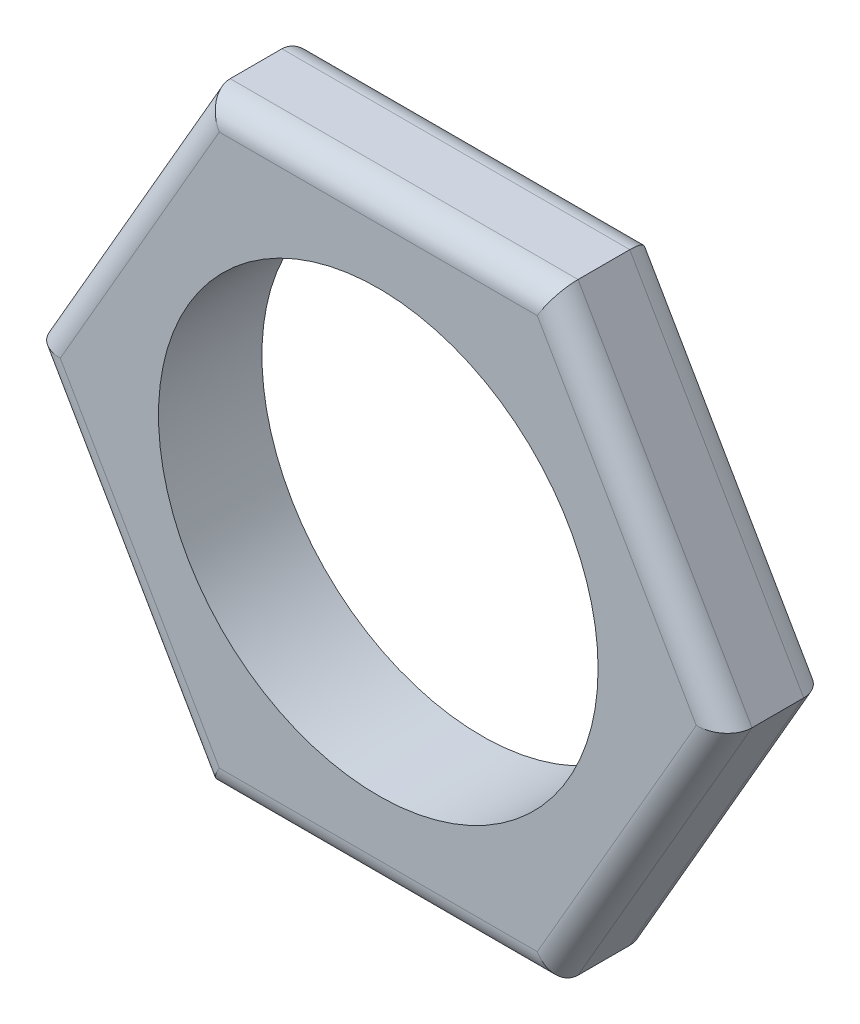
from build123d import *

# Parameters (mm, degrees)
SKETCH1_R      = 4.317999999999999
EXTRUDE1_DEPTH = 2.032
FILLET1_R      = 0.508


with BuildPart() as part:
    # Sketch1 → Extrude1 (new body)
    with BuildSketch(Plane.XY):
        Polygon((-5.125311544677072, 2.9590999999999883), (-6.833748726236091, -2.364e-14), (-5.125311544677051, -2.959100000000024), (-3.4168743631180254, -5.918200000000001), (0, -5.918200000000001), (3.4168743631180534, -5.918200000000001), (5.125311544677072, -2.9590999999999883), (6.833748726236091, 2.45e-14), (5.125311544677051, 2.959100000000024), (3.4168743631180254, 5.918200000000001), (0, 5.918200000000001), (-3.4168743631180534, 5.918200000000001), align=None)
        Circle(SKETCH1_R, mode=Mode.SUBTRACT)
    extrude(amount=EXTRUDE1_DEPTH)

    # Fillet1
    fillet1_edges = [part.edges().sort_by_distance(p)[0] for p in [
        (-5.125311544677058, -2.9591000000000123, 2.032),
        (-1.421e-14, 5.918200000000001, 0),
        (5.125311544677058, 2.9591000000000123, 0),
        (5.125311544677072, -2.959099999999988, 0),
        (1.421e-14, -5.918200000000001, 0),
        (-5.125311544677058, -2.959100000000012, 0),
        (-5.125311544677072, 2.9590999999999883, 0),
        (1.377e-14, -5.918200000000001, 2.032),
        (5.125311544677072, -2.9590999999999883, 2.032),
        (5.125311544677058, 2.9591000000000127, 2.032),
        (-1.377e-14, 5.918200000000001, 2.032),
        (-5.125311544677072, 2.9590999999999887, 2.032),
    ]]
    fillet(fillet1_edges, radius=FILLET1_R)


solid = part.part
